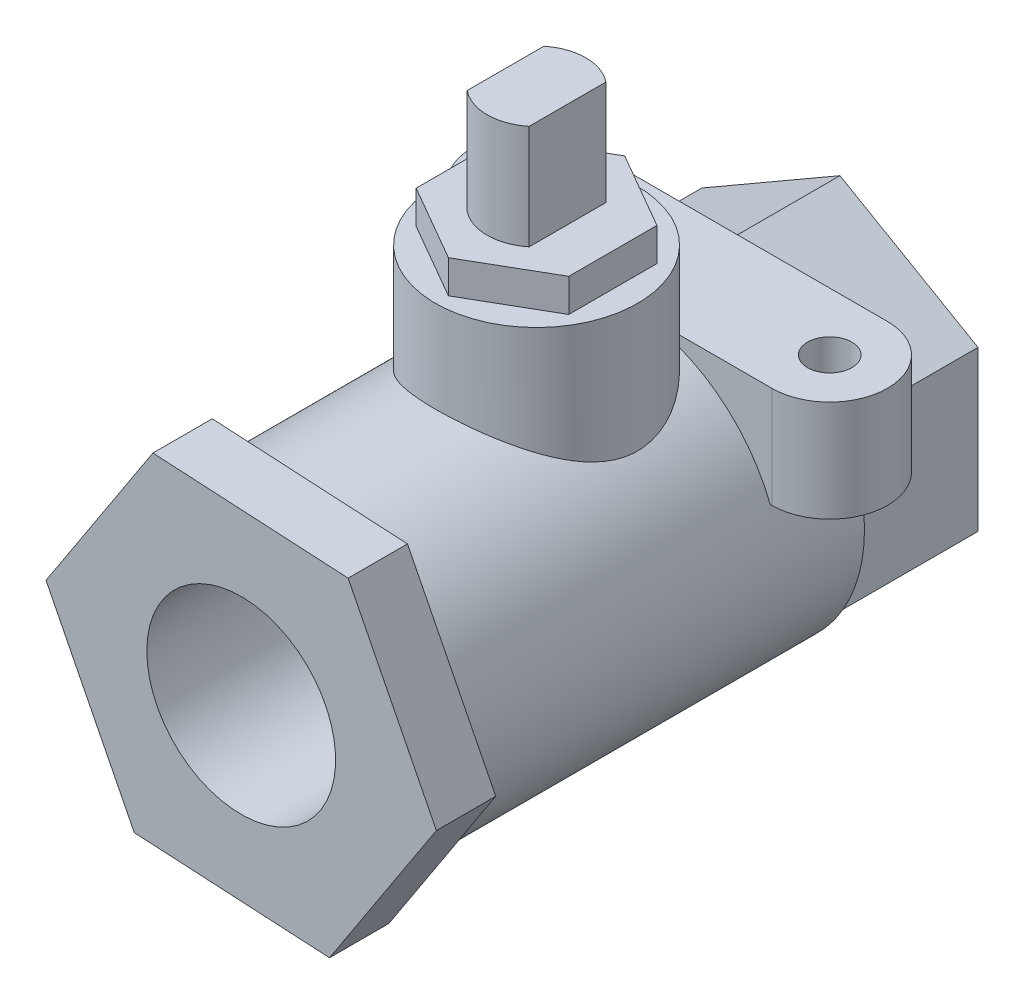
from build123d import *

# Parameters (mm, degrees)
SKETCH1_R                = 15.0114
BOSS_EXTRUDE1_DEPTH      = 38.1
BOSS_EXTRUDE2_DEPTH      = 5.588
BOSS_EXTRUDE3_DEPTH      = 12.7
BOSS_EXTRUDE4_DEPTH      = 9.5504
SKETCH4_R                = 8.89
CUT_EXTRUDE1_DEPTH       = 62.91098247
BOSS_EXTRUDE5_DEPTH      = 8.636
BOSS_EXTRUDE5_DEPTH_BACK = 5.08
SKETCH6_R                = 9.525
BOSS_EXTRUDE6_DEPTH      = 3.1115
SKETCH8_W                = 5.842
SKETCH8_H                = 7.231465202
BOSS_EXTRUDE7_DEPTH      = 9.8298
SKETCH9_R                = 2.08915
CUT_EXTRUDE2_DEPTH       = 8.89


with BuildPart() as part:
    # Sketch1 → Boss-Extrude1 (new body)
    with BuildSketch(Plane.XY):
        with Locations(Location((0, 0, 0), (0, 0, 180))):
            Circle(SKETCH1_R)
    extrude(amount=BOSS_EXTRUDE1_DEPTH)

    # Sketch2 → Boss-Extrude2 (add)
    with BuildSketch(Plane.XY.offset(38.1)):
        Polygon((-8.314485622, 16.42722286), (-18.383635121, 1.013055662), (-10.069149499, -15.414167198), (8.314485622, -16.42722286), (18.383635121, -1.013055662), (10.069149499, 15.414167198), align=None)
    extrude(amount=BOSS_EXTRUDE2_DEPTH)

    # Sketch3 → Boss-Extrude3 (add)
    with BuildSketch(Plane(origin=(0, 0, 0), x_dir=(-1, 0, 0), z_dir=(0, 0, -1))):
        Polygon((0, 15.0114), (-13.000253746, 7.5057), (-13.000253746, -7.5057), (0, -15.0114), (13.000253746, -7.5057), (13.000253746, 7.5057), align=None)
    extrude(amount=BOSS_EXTRUDE3_DEPTH)

    # Sketch5 → Boss-Extrude4 (add)
    with BuildSketch(Plane(origin=(0, 15.0114, 0), x_dir=(1, 0, 0), z_dir=(0, 1, 0))):
        with BuildLine():
            Line((-14.1351, 3.048), (14.1351, 3.048))
            ThreePointArc((14.1351, 3.048), (19.5834, -2.4003), (14.1351, -7.8486))
            Line((14.1351, -7.8486), (-14.1351, -7.8486))
            ThreePointArc((-14.1351, -7.8486), (-19.5834, -2.4003), (-14.1351, 3.048))
        make_face()
    extrude(amount=-BOSS_EXTRUDE4_DEPTH)

    # Sketch4 → Cut-Extrude1 (cut, through all)
    with BuildSketch(Plane(origin=(0, 0, -12.7), x_dir=(-1, 0, 0), z_dir=(0, 0, -1))):
        Circle(SKETCH4_R)
    extrude(amount=-CUT_EXTRUDE1_DEPTH, mode=Mode.SUBTRACT)

    # Sketch6 → Boss-Extrude5 (add, two sides: drawn at the far end of the back side and taken through both)
    with BuildSketch(Plane(origin=(0, 15.0114, 0), x_dir=(1, 0, 0), z_dir=(0, 1, 0)).offset(-BOSS_EXTRUDE5_DEPTH_BACK)):
        with Locations(Location((0, -15.875, 0), (0, 0, 180))):
            Circle(SKETCH6_R)
    extrude(amount=BOSS_EXTRUDE5_DEPTH + BOSS_EXTRUDE5_DEPTH_BACK)

    # Sketch7 → Boss-Extrude6 (add)
    with BuildSketch(Plane(origin=(0, 23.6474, 0), x_dir=(1, 0, 0), z_dir=(0, 1, 0))):
        Polygon((0, -7.57478159), (-7.1882, -11.724890795), (-7.1882, -20.025109205), (0, -24.17521841), (7.1882, -20.025109205), (7.1882, -11.724890795), align=None)
    extrude(amount=BOSS_EXTRUDE6_DEPTH)

    # Sketch8 → Boss-Extrude7 (add)
    with BuildSketch(Plane(origin=(0, 26.7589, 0), x_dir=(1, 0, 0), z_dir=(0, 1, 0))):
        with Locations((0, -15.875)):
            Rectangle(SKETCH8_W, SKETCH8_H)
        with BuildLine():
            ThreePointArc((2.921, -12.259267399), (0, -11.2268), (-2.921, -12.259267399))
            Line((-2.921, -12.259267399), (2.921, -12.259267399))
        make_face()
        with BuildLine():
            Line((2.921, -19.490732601), (-2.921, -19.490732601))
            ThreePointArc((-2.921, -19.490732601), (0, -20.5232), (2.921, -19.490732601))
        make_face()
    extrude(amount=BOSS_EXTRUDE7_DEPTH)

    # Sketch9 → Cut-Extrude2 (cut)
    with BuildSketch(Plane(origin=(0, 15.0114, 0), x_dir=(1, 0, 0), z_dir=(0, 1, 0))):
        with Locations(Location((14.1351, -2.4003, 0), (0, 0, 180))):
            Circle(SKETCH9_R)
        with Locations(Location((-14.1351, -2.4003, 0), (0, 0, 180))):
            Circle(SKETCH9_R)
    extrude(amount=-CUT_EXTRUDE2_DEPTH, mode=Mode.SUBTRACT)


solid = part.part
